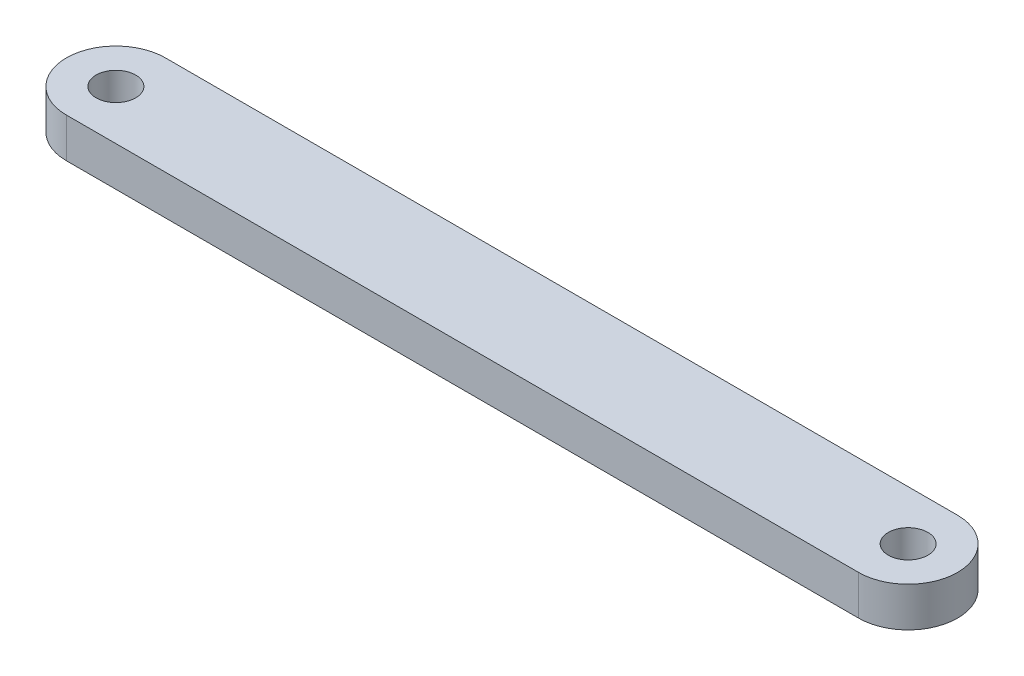
from build123d import *

# Parameters (mm, degrees)
SKETCH1_R           = 1
BOSS_EXTRUDE1_DEPTH = 2


with BuildPart() as part:
    # Sketch1 → Boss-Extrude1 (new body)
    with BuildSketch(Plane(origin=(0, 0, 0), x_dir=(1, 0, 0), z_dir=(0, 1, 0))):
        with BuildLine():
            Line((-10, 2.5), (30, 2.5))
            ThreePointArc((30, 2.5), (32.5, 0), (30, -2.5))
            Line((30, -2.5), (-10, -2.5))
            ThreePointArc((-10, -2.5), (-12.5, 0), (-10, 2.5))
        make_face()
        with Locations(Location((30, 0, 0), (0, 0, 270))):
            Circle(SKETCH1_R, mode=Mode.SUBTRACT)
        with Locations(Location((-10, 0, 0), (0, 0, 270))):
            Circle(SKETCH1_R, mode=Mode.SUBTRACT)
    extrude(amount=BOSS_EXTRUDE1_DEPTH)


solid = part.part
